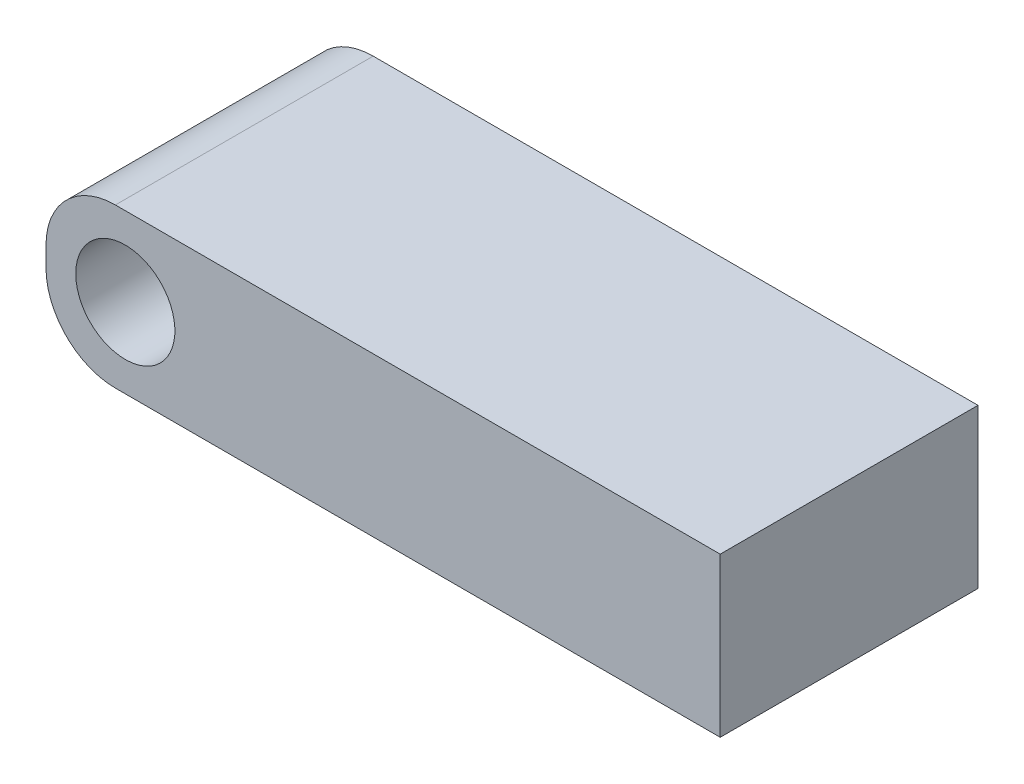
from build123d import *

# Parameters (mm, degrees)
SKETCH1_R           = 2.5
BOSS_EXTRUDE1_DEPTH = 6.5


with BuildPart() as part:
    # Sketch1 → Boss-Extrude1 (new, symmetric)
    with BuildSketch(Plane.XY):
        with BuildLine():
            Line((-19.5, 34.428638458), (11, 34.428638458))
            Line((11, 34.428638458), (11, 26.428638458))
            Line((11, 26.428638458), (-19.5, 26.428638458))
            ThreePointArc((-19.5, 26.428638458), (-21.974873734, 27.453764724), (-23, 29.928638458))
            Line((-23, 29.928638458), (-23, 30.928638458))
            ThreePointArc((-23, 30.928638458), (-21.974873734, 33.403512192), (-19.5, 34.428638458))
        make_face()
        with Locations(Location((-19, 30.428638458, 0), (0, 0, 180))):
            Circle(SKETCH1_R, mode=Mode.SUBTRACT)
    extrude(amount=BOSS_EXTRUDE1_DEPTH, both=True)


solid = part.part
